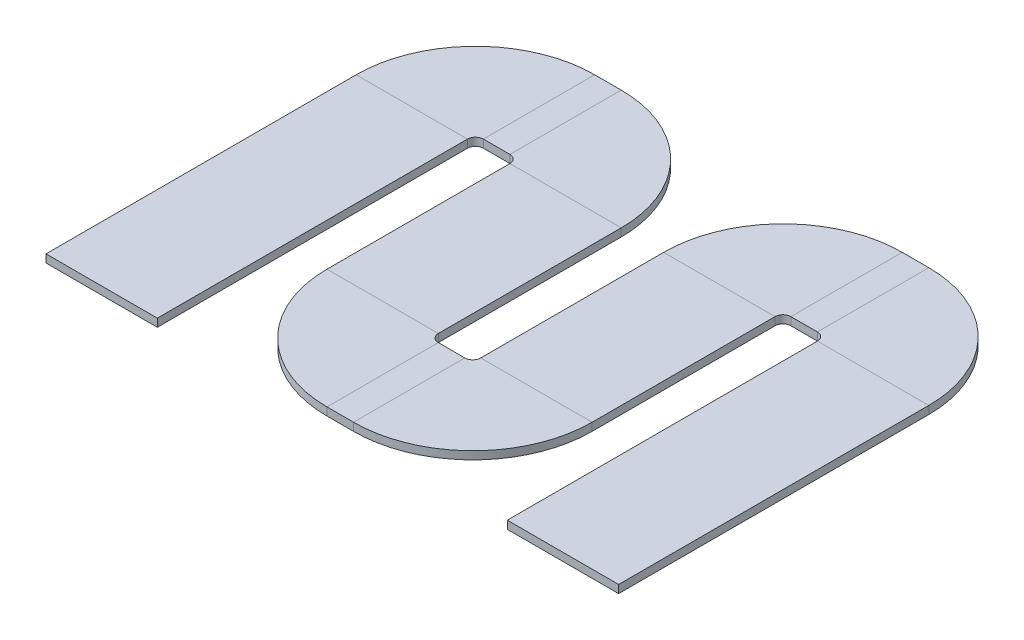
from build123d import *

# Parameters (mm, degrees)
SKETCH6_W = 44.45
SKETCH6_H = 3.175


with BuildPart() as part:
    # Sweep1: sweep along a path in Sketch1
    with BuildLine(Plane(origin=(0, 0, 0), x_dir=(1, 0, 0), z_dir=(0, 1, 0))) as sweep1_path:
        Line((0, 0), (0, 123.825))
        ThreePointArc((0, 123.825), (7.439487758, 141.785512242), (25.4, 149.225))
        Line((25.4, 149.225), (35.9918, 149.225))
        ThreePointArc((35.9918, 149.225), (53.952312242, 141.785512242), (61.3918, 123.825))
        Line((61.3918, 123.825), (61.3918, 50.8))
        ThreePointArc((61.3918, 50.8), (68.831287758, 32.839487758), (86.7918, 25.4))
        Line((86.7918, 25.4), (97.3836, 25.4))
        ThreePointArc((97.3836, 25.4), (115.344112242, 32.839487758), (122.7836, 50.8))
        Line((122.7836, 50.8), (122.7836, 123.825))
        ThreePointArc((122.7836, 123.825), (130.223087758, 141.785512242), (148.1836, 149.225))
        Line((148.1836, 149.225), (158.7754, 149.225))
        ThreePointArc((158.7754, 149.225), (176.735912242, 141.785512242), (184.1754, 123.825))
        Line((184.1754, 123.825), (184.1754, 0))
    # Sketch6 → Sweep1 (sweep)
    with BuildSketch(Plane.XY):
        with Locations((0, -11.1125)):
            Rectangle(SKETCH6_W, SKETCH6_H)
    sweep(path=sweep1_path.line)


solid = part.part
